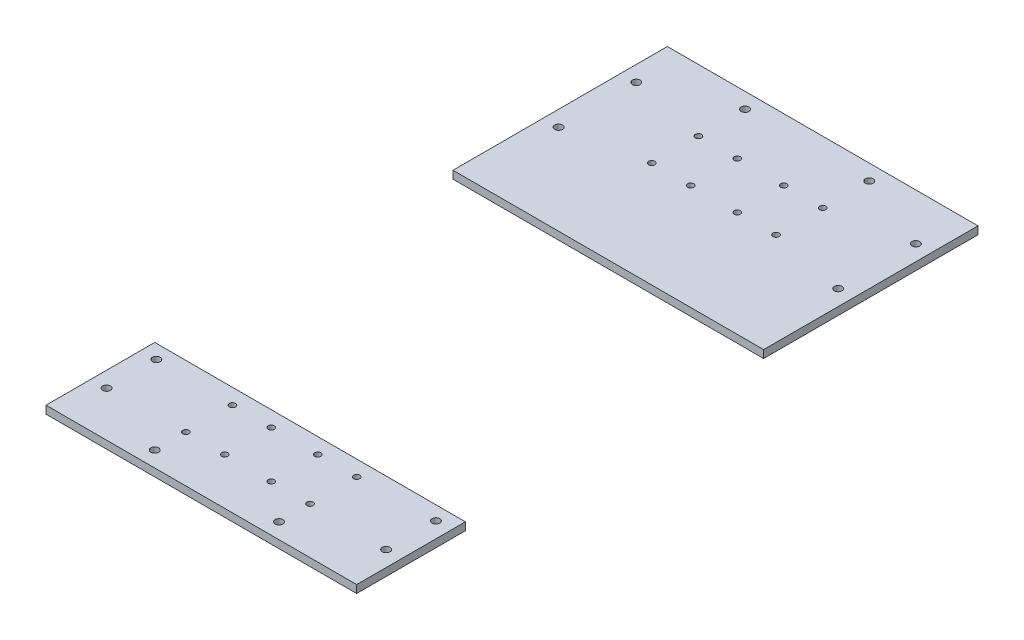
from build123d import *

# Parameters (mm, degrees)
SKETCH_1_W                      = 200
SKETCH_1_H                      = 70
EXTRUDE_1_DEPTH                 = 5
SKETCH_1_H_2                    = 138
EXTRUDE_1_2_DEPTH               = 5
SKETCH_2_W                      = 2
SKETCH_2_H                      = 5
HOLE_WIZARD_4_0_4_1_AT_2_COUNT  = 2
HOLE_WIZARD_4_0_4_1_AT_2_PITCH  = 25
HOLE_WIZARD_4_0_4_1_AT_3_COUNT  = 2
HOLE_WIZARD_4_0_4_1_AT_3_PITCH  = 30
HOLE_WIZARD_4_0_4_1_AT_4_COUNT  = 2
HOLE_WIZARD_4_0_4_1_AT_4_PITCH  = 39.05124838
HOLE_WIZARD_4_0_4_1_AT_5_COUNT  = 2
HOLE_WIZARD_4_0_4_1_AT_5_PITCH  = 55
HOLE_WIZARD_4_0_4_1_AT_6_COUNT  = 2
HOLE_WIZARD_4_0_4_1_AT_6_PITCH  = 80
HOLE_WIZARD_4_0_4_1_AT_7_COUNT  = 2
HOLE_WIZARD_4_0_4_1_AT_7_PITCH  = 62.649820431
HOLE_WIZARD_4_0_4_1_AT_8_COUNT  = 2
HOLE_WIZARD_4_0_4_1_AT_8_PITCH  = 85.440037453
HOLE_WIZARD_4_0_4_1_AT_9_COUNT  = 2
HOLE_WIZARD_4_0_4_1_AT_9_PITCH  = 300
HOLE_WIZARD_4_0_4_1_AT_10_COUNT = 2
HOLE_WIZARD_4_0_4_1_AT_10_PITCH = 301.03986447
HOLE_WIZARD_4_0_4_1_AT_11_COUNT = 2
HOLE_WIZARD_4_0_4_1_AT_11_PITCH = 330
HOLE_WIZARD_4_0_4_1_AT_12_COUNT = 2
HOLE_WIZARD_4_0_4_1_AT_12_PITCH = 330.945614867
HOLE_WIZARD_4_0_4_1_AT_13_COUNT = 2
HOLE_WIZARD_4_0_4_1_AT_13_PITCH = 305
HOLE_WIZARD_4_0_4_1_AT_14_COUNT = 2
HOLE_WIZARD_4_0_4_1_AT_14_PITCH = 310.483493925
HOLE_WIZARD_4_0_4_1_AT_15_COUNT = 2
HOLE_WIZARD_4_0_4_1_AT_15_PITCH = 334.551939166
HOLE_WIZARD_4_0_4_1_AT_16_COUNT = 2
HOLE_WIZARD_4_0_4_1_AT_16_PITCH = 339.558536927
SKETCH_4_W                      = 2.5
SKETCH_4_H                      = 5
HOLE_WIZARD_5_0_5_1_AT_2_COUNT  = 2
HOLE_WIZARD_5_0_5_1_AT_2_PITCH  = 50
HOLE_WIZARD_5_0_5_1_AT_3_COUNT  = 2
HOLE_WIZARD_5_0_5_1_AT_3_PITCH  = 180
HOLE_WIZARD_5_0_5_1_AT_4_COUNT  = 2
HOLE_WIZARD_5_0_5_1_AT_4_PITCH  = 186.815416923
HOLE_WIZARD_5_0_5_1_AT_5_COUNT  = 2
HOLE_WIZARD_5_0_5_1_AT_5_PITCH  = 357.604530173
HOLE_WIZARD_5_0_5_1_AT_6_COUNT  = 2
HOLE_WIZARD_5_0_5_1_AT_6_PITCH  = 385.591753024
HOLE_WIZARD_5_0_5_1_AT_7_COUNT  = 2
HOLE_WIZARD_5_0_5_1_AT_7_PITCH  = 309
HOLE_WIZARD_5_0_5_1_AT_8_COUNT  = 2
HOLE_WIZARD_5_0_5_1_AT_8_PITCH  = 341
HOLE_WIZARD_5_0_5_1_AT_9_COUNT  = 2
HOLE_WIZARD_5_0_5_1_AT_9_PITCH  = 53.851648071
HOLE_WIZARD_5_0_5_1_AT_10_COUNT = 2
HOLE_WIZARD_5_0_5_1_AT_10_PITCH = 131.52946438
HOLE_WIZARD_5_0_5_1_AT_11_COUNT = 2
HOLE_WIZARD_5_0_5_1_AT_11_PITCH = 363.455636908
HOLE_WIZARD_5_0_5_1_AT_12_COUNT = 2
HOLE_WIZARD_5_0_5_1_AT_12_PITCH = 382.75318418


with BuildPart() as part:
    # 草图1 → 凸台-拉伸1 (new body)
    with BuildSketch(Plane(origin=(0, 0, 0), x_dir=(1, 0, 0), z_dir=(0, 1, 0))):
        with Locations((100, 35)):
            Rectangle(SKETCH_1_W, SKETCH_1_H)
    extrude(amount=EXTRUDE_1_DEPTH)


with BuildPart() as body_2:
    # 草图1 → Extrude 1 2 (new body)
    with BuildSketch(Plane(origin=(0, 0, 0), x_dir=(1, 0, 0), z_dir=(0, 1, 0))):
        with Locations((100, 331)):
            Rectangle(SKETCH_1_W, SKETCH_1_H_2)
    extrude(amount=EXTRUDE_1_2_DEPTH)

    # 草图2 → Ø4.0 (4) 直径孔1 (revolve, cut)
    with BuildSketch(Plane(origin=(60, 5, -360), x_dir=(0, 0, 1), z_dir=(1, 0, 0))):
        with Locations((1, 2.5)):
            Rectangle(SKETCH_2_W, SKETCH_2_H)
    hole_wizard_4_0_4_1 = revolve(axis=Axis((60, 11.35, -360), (0, -1, 0)), mode=Mode.SUBTRACT)

    # Ø4.0 (4) 直径孔1 at 2: Ø4.0 (4) 直径孔1 ×2
    with Locations(*[(i * HOLE_WIZARD_4_0_4_1_AT_2_PITCH, 0, 0) for i in range(1, HOLE_WIZARD_4_0_4_1_AT_2_COUNT)]):
        add(hole_wizard_4_0_4_1, mode=Mode.SUBTRACT)

    # Ø4.0 (4) 直径孔1 at 3: Ø4.0 (4) 直径孔1 ×2
    with Locations(*[(0, 0, i * HOLE_WIZARD_4_0_4_1_AT_3_PITCH) for i in range(1, HOLE_WIZARD_4_0_4_1_AT_3_COUNT)]):
        add(hole_wizard_4_0_4_1, mode=Mode.SUBTRACT)

    # Ø4.0 (4) 直径孔1 at 4: Ø4.0 (4) 直径孔1 ×2
    with Locations(*[Vector(0.6401843996644797, 0, 0.7682212795973761) * (i * HOLE_WIZARD_4_0_4_1_AT_4_PITCH) for i in range(1, HOLE_WIZARD_4_0_4_1_AT_4_COUNT)]):
        add(hole_wizard_4_0_4_1, mode=Mode.SUBTRACT)

    # Ø4.0 (4) 直径孔1 at 5: Ø4.0 (4) 直径孔1 ×2
    with Locations(*[(i * HOLE_WIZARD_4_0_4_1_AT_5_PITCH, 0, 0) for i in range(1, HOLE_WIZARD_4_0_4_1_AT_5_COUNT)]):
        add(hole_wizard_4_0_4_1, mode=Mode.SUBTRACT)

    # Ø4.0 (4) 直径孔1 at 6: Ø4.0 (4) 直径孔1 ×2
    with Locations(*[(i * HOLE_WIZARD_4_0_4_1_AT_6_PITCH, 0, 0) for i in range(1, HOLE_WIZARD_4_0_4_1_AT_6_COUNT)]):
        add(hole_wizard_4_0_4_1, mode=Mode.SUBTRACT)

    # Ø4.0 (4) 直径孔1 at 7: Ø4.0 (4) 直径孔1 ×2
    with Locations(*[Vector(0.8778955729143845, 0, 0.47885213068057325) * (i * HOLE_WIZARD_4_0_4_1_AT_7_PITCH) for i in range(1, HOLE_WIZARD_4_0_4_1_AT_7_COUNT)]):
        add(hole_wizard_4_0_4_1, mode=Mode.SUBTRACT)

    # Ø4.0 (4) 直径孔1 at 8: Ø4.0 (4) 直径孔1 ×2
    with Locations(*[Vector(0.9363291775690445, 0, 0.3511234415883917) * (i * HOLE_WIZARD_4_0_4_1_AT_8_PITCH) for i in range(1, HOLE_WIZARD_4_0_4_1_AT_8_COUNT)]):
        add(hole_wizard_4_0_4_1, mode=Mode.SUBTRACT)

    # 草图4 → Ø5.0 (5) 直径孔1 (revolve, cut)
    with BuildSketch(Plane(origin=(10, 5, -370), x_dir=(0, 0, 1), z_dir=(1, 0, 0))):
        with Locations((1.25, 2.5)):
            Rectangle(SKETCH_4_W, SKETCH_4_H)
    hole_wizard_5_0_5_1 = revolve(axis=Axis((10, 11.35, -370), (0, -1, 0)), mode=Mode.SUBTRACT)

    # Ø5.0 (5) 直径孔1 at 2: Ø5.0 (5) 直径孔1 ×2
    with Locations(*[(0, 0, i * HOLE_WIZARD_5_0_5_1_AT_2_PITCH) for i in range(1, HOLE_WIZARD_5_0_5_1_AT_2_COUNT)]):
        add(hole_wizard_5_0_5_1, mode=Mode.SUBTRACT)

    # Ø5.0 (5) 直径孔1 at 3: Ø5.0 (5) 直径孔1 ×2
    with Locations(*[(i * HOLE_WIZARD_5_0_5_1_AT_3_PITCH, 0, 0) for i in range(1, HOLE_WIZARD_5_0_5_1_AT_3_COUNT)]):
        add(hole_wizard_5_0_5_1, mode=Mode.SUBTRACT)

    # Ø5.0 (5) 直径孔1 at 4: Ø5.0 (5) 直径孔1 ×2
    with Locations(*[Vector(0.9635179096299407, 0, 0.26764386378609467) * (i * HOLE_WIZARD_5_0_5_1_AT_4_PITCH) for i in range(1, HOLE_WIZARD_5_0_5_1_AT_4_COUNT)]):
        add(hole_wizard_5_0_5_1, mode=Mode.SUBTRACT)

    # Ø5.0 (5) 直径孔1 at 9: Ø5.0 (5) 直径孔1 ×2
    with Locations(*[Vector(0.928476690885259, 0, -0.37139067635410467) * (i * HOLE_WIZARD_5_0_5_1_AT_9_PITCH) for i in range(1, HOLE_WIZARD_5_0_5_1_AT_9_COUNT)]):
        add(hole_wizard_5_0_5_1, mode=Mode.SUBTRACT)

    # Ø5.0 (5) 直径孔1 at 10: Ø5.0 (5) 直径孔1 ×2
    with Locations(*[Vector(0.9883716976506172, 0, -0.15205718425394152) * (i * HOLE_WIZARD_5_0_5_1_AT_10_PITCH) for i in range(1, HOLE_WIZARD_5_0_5_1_AT_10_COUNT)]):
        add(hole_wizard_5_0_5_1, mode=Mode.SUBTRACT)


with BuildPart() as part_1:
    add(part.part)

    # Ø4.0 (4) 直径孔1 at 9: Ø4.0 (4) 直径孔1 ×2
    with Locations(*[(0, 0, i * HOLE_WIZARD_4_0_4_1_AT_9_PITCH) for i in range(1, HOLE_WIZARD_4_0_4_1_AT_9_COUNT)]):
        add(hole_wizard_4_0_4_1, mode=Mode.SUBTRACT)

    # Ø4.0 (4) 直径孔1 at 10: Ø4.0 (4) 直径孔1 ×2
    with Locations(*[Vector(0.08304547985373993, 0, 0.9965457582448797) * (i * HOLE_WIZARD_4_0_4_1_AT_10_PITCH) for i in range(1, HOLE_WIZARD_4_0_4_1_AT_10_COUNT)]):
        add(hole_wizard_4_0_4_1, mode=Mode.SUBTRACT)

    # Ø4.0 (4) 直径孔1 at 11: Ø4.0 (4) 直径孔1 ×2
    with Locations(*[(0, 0, i * HOLE_WIZARD_4_0_4_1_AT_11_PITCH) for i in range(1, HOLE_WIZARD_4_0_4_1_AT_11_COUNT)]):
        add(hole_wizard_4_0_4_1, mode=Mode.SUBTRACT)

    # Ø4.0 (4) 直径孔1 at 12: Ø4.0 (4) 直径孔1 ×2
    with Locations(*[Vector(0.07554111272939011, 0, 0.99714268802795) * (i * HOLE_WIZARD_4_0_4_1_AT_12_PITCH) for i in range(1, HOLE_WIZARD_4_0_4_1_AT_12_COUNT)]):
        add(hole_wizard_4_0_4_1, mode=Mode.SUBTRACT)

    # Ø4.0 (4) 直径孔1 at 13: Ø4.0 (4) 直径孔1 ×2
    with Locations(*[Vector(0.18032786885245905, 0, 0.9836065573770492) * (i * HOLE_WIZARD_4_0_4_1_AT_13_PITCH) for i in range(1, HOLE_WIZARD_4_0_4_1_AT_13_COUNT)]):
        add(hole_wizard_4_0_4_1, mode=Mode.SUBTRACT)

    # Ø4.0 (4) 直径孔1 at 14: Ø4.0 (4) 直径孔1 ×2
    with Locations(*[Vector(0.25766265056033233, 0, 0.9662349396012463) * (i * HOLE_WIZARD_4_0_4_1_AT_14_PITCH) for i in range(1, HOLE_WIZARD_4_0_4_1_AT_14_COUNT)]):
        add(hole_wizard_4_0_4_1, mode=Mode.SUBTRACT)

    # Ø4.0 (4) 直径孔1 at 15: Ø4.0 (4) 直径孔1 ×2
    with Locations(*[Vector(0.16439898730535735, 0, 0.9863939238321437) * (i * HOLE_WIZARD_4_0_4_1_AT_15_PITCH) for i in range(1, HOLE_WIZARD_4_0_4_1_AT_15_COUNT)]):
        add(hole_wizard_4_0_4_1, mode=Mode.SUBTRACT)

    # Ø4.0 (4) 直径孔1 at 16: Ø4.0 (4) 直径孔1 ×2
    with Locations(*[Vector(0.2356000256215042, 0, 0.9718501056887048) * (i * HOLE_WIZARD_4_0_4_1_AT_16_PITCH) for i in range(1, HOLE_WIZARD_4_0_4_1_AT_16_COUNT)]):
        add(hole_wizard_4_0_4_1, mode=Mode.SUBTRACT)

    # Ø5.0 (5) 直径孔1 at 5: Ø5.0 (5) 直径孔1 ×2
    with Locations(*[Vector(0.5033493281337852, 0, 0.864083013296331) * (i * HOLE_WIZARD_5_0_5_1_AT_5_PITCH) for i in range(1, HOLE_WIZARD_5_0_5_1_AT_5_COUNT)]):
        add(hole_wizard_5_0_5_1, mode=Mode.SUBTRACT)

    # Ø5.0 (5) 直径孔1 at 6: Ø5.0 (5) 直径孔1 ×2
    with Locations(*[Vector(0.466814963205061, 0, 0.8843550136273653) * (i * HOLE_WIZARD_5_0_5_1_AT_6_PITCH) for i in range(1, HOLE_WIZARD_5_0_5_1_AT_6_COUNT)]):
        add(hole_wizard_5_0_5_1, mode=Mode.SUBTRACT)

    # Ø5.0 (5) 直径孔1 at 7: Ø5.0 (5) 直径孔1 ×2
    with Locations(*[(0, 0, i * HOLE_WIZARD_5_0_5_1_AT_7_PITCH) for i in range(1, HOLE_WIZARD_5_0_5_1_AT_7_COUNT)]):
        add(hole_wizard_5_0_5_1, mode=Mode.SUBTRACT)

    # Ø5.0 (5) 直径孔1 at 8: Ø5.0 (5) 直径孔1 ×2
    with Locations(*[(0, 0, i * HOLE_WIZARD_5_0_5_1_AT_8_PITCH) for i in range(1, HOLE_WIZARD_5_0_5_1_AT_8_COUNT)]):
        add(hole_wizard_5_0_5_1, mode=Mode.SUBTRACT)

    # Ø5.0 (5) 直径孔1 at 11: Ø5.0 (5) 直径孔1 ×2
    with Locations(*[Vector(0.13756837127468777, 0, 0.9904922731777517) * (i * HOLE_WIZARD_5_0_5_1_AT_11_PITCH) for i in range(1, HOLE_WIZARD_5_0_5_1_AT_11_COUNT)]):
        add(hole_wizard_5_0_5_1, mode=Mode.SUBTRACT)

    # Ø5.0 (5) 直径孔1 at 12: Ø5.0 (5) 直径孔1 ×2
    with Locations(*[Vector(0.3396444637775568, 0, 0.9405538996916956) * (i * HOLE_WIZARD_5_0_5_1_AT_12_PITCH) for i in range(1, HOLE_WIZARD_5_0_5_1_AT_12_COUNT)]):
        add(hole_wizard_5_0_5_1, mode=Mode.SUBTRACT)


solid = Compound([body_2.part, part_1.part])
